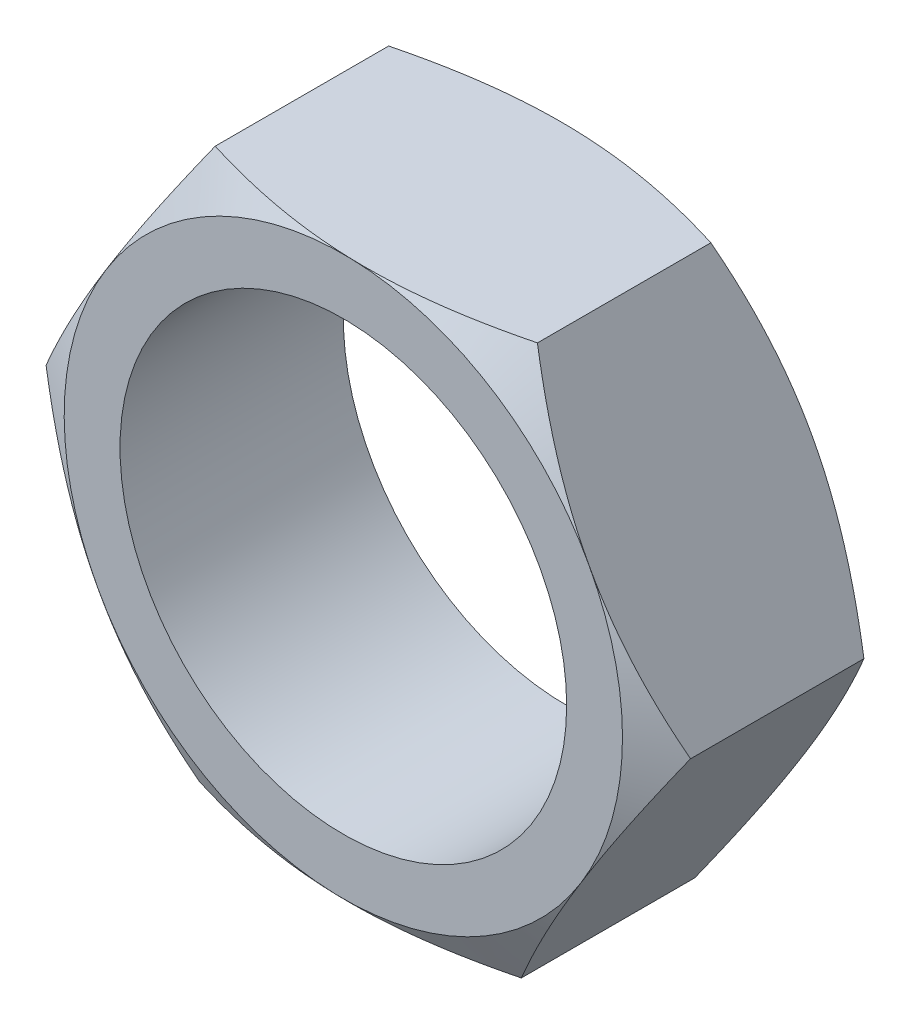
from build123d import *

# Parameters (mm, degrees)
SKETCH1_R           = 5
BOSS_EXTRUDE1_DEPTH = 5
SKETCH2_OUTSIDE_W   = 61.396
SKETCH2_OUTSIDE_H   = 59.67
SKETCH2_OUTSIDE_R   = 6.25
CUT_EXTRUDE1_DEPTH  = 11.834213761
CUT_EXTRUDE1_DRAFT  = -60
SKETCH3_OUTSIDE_W   = 61.396
SKETCH3_OUTSIDE_H   = 59.67
SKETCH3_OUTSIDE_R   = 6.25
CUT_EXTRUDE2_DEPTH  = 11.834213761
CUT_EXTRUDE2_DRAFT  = -60


with BuildPart() as part:
    # Sketch1 → Boss-Extrude1 (new body)
    with BuildSketch(Plane.XY):
        Polygon((3.787041695, 6.143423194), (-3.426839705, 6.35138591), (-7.213881399, 0.207962716), (-3.787041695, -6.143423194), (3.426839705, -6.35138591), (7.213881399, -0.207962716), align=None)
        Circle(SKETCH1_R, mode=Mode.SUBTRACT)
    extrude(amount=BOSS_EXTRUDE1_DEPTH)


with BuildPart() as cut_extrude1_tool:
    # Sketch2 outside → Cut-Extrude1 (with draft: the straight prism first)
    with BuildSketch(Plane.XY.offset(5)):
        Rectangle(SKETCH2_OUTSIDE_W, SKETCH2_OUTSIDE_H)
        Circle(SKETCH2_OUTSIDE_R, mode=Mode.SUBTRACT)
    extrude(amount=-CUT_EXTRUDE1_DEPTH)
    # Cut-Extrude1: the draft: its side faces are tilted about the plane it starts from
    cut_extrude1_sides = [cut_extrude1_tool.faces().sort_by_distance(p)[0] for p in [
        (0, -29.835, -0.91710688),
        (30.698, 0, -0.91710688),
        (0, 29.835, -0.91710688),
        (-30.698, 0, -0.91710688),
        (-6.25, 0, -0.91710688),
    ]]
    draft(cut_extrude1_sides, Plane.XY.offset(5), CUT_EXTRUDE1_DRAFT)


with BuildPart() as part_1:
    add(part.part)

    # Cut-Extrude1: cut by cut_extrude1_tool
    add(cut_extrude1_tool.part, mode=Mode.SUBTRACT)


with BuildPart() as cut_extrude2_tool:
    # Sketch3 outside → Cut-Extrude2 (with draft: the straight prism first)
    with BuildSketch(Plane(origin=(0, 0, 0), x_dir=(-1, 0, 0), z_dir=(0, 0, -1))):
        Rectangle(SKETCH3_OUTSIDE_W, SKETCH3_OUTSIDE_H)
        Circle(SKETCH3_OUTSIDE_R, mode=Mode.SUBTRACT)
    extrude(amount=-CUT_EXTRUDE2_DEPTH)
    # Cut-Extrude2: the draft: its side faces are tilted about the plane it starts from
    cut_extrude2_sides = [cut_extrude2_tool.faces().sort_by_distance(p)[0] for p in [
        (0, -29.835, 5.91710688),
        (-30.698, 0, 5.91710688),
        (0, 29.835, 5.91710688),
        (30.698, 0, 5.91710688),
        (6.25, 0, 5.91710688),
    ]]
    draft(cut_extrude2_sides, Plane(origin=(0, 0, 0), x_dir=(-1, 0, 0), z_dir=(0, 0, -1)), CUT_EXTRUDE2_DRAFT)


with BuildPart() as part_2:
    add(part_1.part)

    # Cut-Extrude2: cut by cut_extrude2_tool
    add(cut_extrude2_tool.part, mode=Mode.SUBTRACT)


solid = part_2.part
